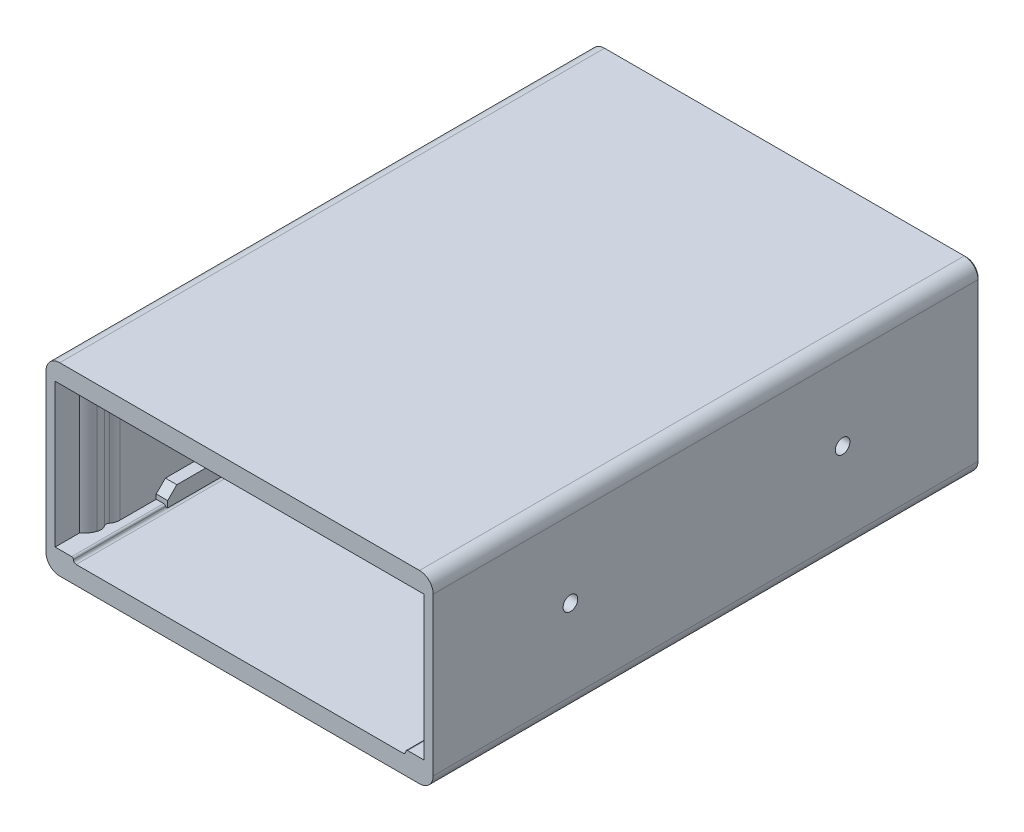
from build123d import *

# Parameters (mm, degrees)
EXTRUDE_1_DEPTH     = 119.5
CUT_EXTRUDE_1_DEPTH = 115.5
SKETCH_3_R          = 1.4
CUT_EXTRUDE_2_DEPTH = 4
EXTRUDE_2_DEPTH     = 2.5
EXTRUDE_3_DEPTH     = 2.5
CUT_EXTRUDE_3_DEPTH = 31.4
CHAMFER_1_SIZE      = 0.4
SKETCH_3_3_R        = 1.4
CUT_EXTRUDE_4_DEPTH = 2.5
SKETCH_3_4_R        = 1.4
CUT_EXTRUDE_5_DEPTH = 4
SKETCH_9_R          = 1.6
CUT_EXTRUDE_6_DEPTH = 148.893469266
CHAMFER_4_SIZE      = 0.4
CHAMFER_5_SIZE      = 0.4


with BuildPart() as part:
    # 草图1 → 凸台-拉伸1 (new body)
    with BuildSketch(Plane.XY):
        with BuildLine():
            Line((-38.75609893, 20.654436608), (39.89390107, 20.654436608))
            ThreePointArc((39.89390107, 20.654436608), (42.015221413, 19.775756952), (42.89390107, 17.654436608))
            Line((42.89390107, 17.654436608), (42.89390107, -16.745563392))
            ThreePointArc((42.89390107, -16.745563392), (42.015221413, -18.866883735), (39.89390107, -19.745563392))
            Line((39.89390107, -19.745563392), (-38.75609893, -19.745563392))
            ThreePointArc((-38.75609893, -19.745563392), (-40.877419274, -18.866883735), (-41.75609893, -16.745563392))
            Line((-41.75609893, -16.745563392), (-41.75609893, 17.654436608))
            ThreePointArc((-41.75609893, 17.654436608), (-40.877419274, 19.775756952), (-38.75609893, 20.654436608))
        make_face()
    extrude(amount=EXTRUDE_1_DEPTH)

    # 草图2 → 切除-拉伸1 (cut)
    with BuildSketch(Plane.XY.offset(119.5)):
        with BuildLine():
            Line((-37.75609893, 16.654436608), (38.89390107, 16.654436608))
            Line((38.89390107, 16.654436608), (38.89390107, -14.745563392))
            Line((38.89390107, -14.745563392), (37.319829514, -14.745563392))
            ThreePointArc((37.319829514, -14.745563392), (37.022296896, -14.866580802), (36.893704546, -15.160918839))
            ThreePointArc((36.893704546, -15.160918839), (36.712700981, -15.575222133), (36.29390107, -15.745563392))
            Line((36.29390107, -15.745563392), (-35.15609893, -15.745563392))
            ThreePointArc((-35.15609893, -15.745563392), (-35.580362999, -15.56982746), (-35.75609893, -15.145563392))
            Line((-35.75609893, -15.145563392), (-35.75609893, -15.142198174))
            ThreePointArc((-35.75609893, -15.142198174), (-35.868562438, -14.862087147), (-36.147008919, -14.745563392))
            Line((-36.147008919, -14.745563392), (-37.75609893, -14.745563392))
            Line((-37.75609893, -14.745563392), (-37.75609893, 16.654436608))
        make_face()
    extrude(amount=-CUT_EXTRUDE_1_DEPTH, mode=Mode.SUBTRACT)

    # 草图3 → 切除-拉伸2 (cut)
    with BuildSketch(Plane.XY.offset(4)):
        with BuildLine():
            Line((29.39390107, 16.654436608), (-28.25609893, 16.654436608))
            Line((-28.25609893, 16.654436608), (-28.25609893, 12.454436608))
            ThreePointArc((-28.25609893, 12.454436608), (-29.281225196, 9.979562874), (-31.75609893, 8.954436608))
            Line((-31.75609893, 8.954436608), (-37.75609893, 8.954436608))
            Line((-37.75609893, 8.954436608), (-37.75609893, -7.045563392))
            Line((-37.75609893, -7.045563392), (-31.75609893, -7.045563392))
            ThreePointArc((-31.75609893, -7.045563392), (-29.281225196, -8.070689657), (-28.25609893, -10.545563392))
            Line((-28.25609893, -10.545563392), (-28.25609893, -15.745563392))
            Line((-28.25609893, -15.745563392), (29.39390107, -15.745563392))
            Line((29.39390107, -15.745563392), (29.39390107, -10.545563392))
            ThreePointArc((29.39390107, -10.545563392), (30.419027336, -8.070689657), (32.89390107, -7.045563392))
            Line((32.89390107, -7.045563392), (38.89390107, -7.045563392))
            Line((38.89390107, -7.045563392), (38.89390107, 8.954436608))
            Line((38.89390107, 8.954436608), (32.89390107, 8.954436608))
            ThreePointArc((32.89390107, 8.954436608), (30.419027336, 9.979562874), (29.39390107, 12.454436608))
            Line((29.39390107, 12.454436608), (29.39390107, 16.654436608))
        make_face()
        with Locations((-31.75609893, -10.545563392)):
            Circle(SKETCH_3_R)
        with Locations((32.89390107, 12.454436608)):
            Circle(SKETCH_3_R)
        with Locations((32.89390107, -10.545563392)):
            Circle(SKETCH_3_R)
    extrude(amount=-CUT_EXTRUDE_2_DEPTH, mode=Mode.SUBTRACT)

    # 草图4 → 凸台-拉伸2 (add)
    with BuildSketch(Plane.ZY.offset(-38.89390107)):
        Polygon((19.4, 3.254436608), (97.4, 3.254436608), (99.4, 1.254436608), (99.4, 0.654436608), (97.4, -1.345563392), (19.4, -1.345563392), align=None)
        Polygon((20.146290163, 16.654436608), (99.4, 16.654436608), (99.4, 15.654436608), (97.4, 13.654436608), (20.146290163, 13.654436608), align=None)
        Polygon((19.4, -11.745563392), (97.4, -11.745563392), (99.4, -13.745563392), (99.4, -15.145563392), (19.4, -15.145563392), align=None)
    extrude(amount=EXTRUDE_2_DEPTH)

    # 草图6 → 凸台-拉伸3 (add)
    with BuildSketch(Plane(origin=(-37.75609893, 0, 0), x_dir=(0, 0, -1), z_dir=(1, 0, 0))):
        Polygon((-99.4, 16.654436608), (-19.4, 16.654436608), (-19.4, 13.654436608), (-97.4, 13.654436608), (-99.4, 15.654436608), align=None)
        Polygon((-97.4, 3.254436608), (-19.4, 3.254436608), (-19.4, -1.345563392), (-97.4, -1.345563392), (-99.4, 0.654436608), (-99.4, 1.254436608), align=None)
        Polygon((-97.4, -11.745563392), (-19.4, -11.745563392), (-19.4, -15.145563392), (-99.4, -15.145563392), (-99.4, -13.745563392), align=None)
    extrude(amount=EXTRUDE_3_DEPTH)

    # 草图8 → 切除-拉伸3 (cut)
    with BuildSketch(Plane.XZ.offset(-16.654436608)):
        with BuildLine():
            Line((-39.75609893, 114.19), (-39.75609893, 119.5))
            Line((-39.75609893, 119.5), (-34.75609893, 119.5))
            Line((-34.75609893, 119.5), (-34.75609893, 107.305312266))
            Line((-34.75609893, 107.305312266), (-37.75609893, 107.305312266))
            ThreePointArc((-37.75609893, 107.305312266), (-37.902054498, 108.229666299), (-38.325719183, 109.064077255))
            ThreePointArc((-38.325719183, 109.064077255), (-38.505927368, 109.602965716), (-38.346327705, 110.148313046))
            ThreePointArc((-38.346327705, 110.148313046), (-38.025073016, 111.013058128), (-38.12609893, 111.93))
            ThreePointArc((-38.12609893, 111.93), (-38.780481743, 113.175843369), (-39.75609893, 114.19))
        make_face()
        with BuildLine():
            Line((38.89390107, 107.18052563), (35.89390107, 107.18052563))
            Line((35.89390107, 107.18052563), (35.89390107, 119.5))
            Line((35.89390107, 119.5), (40.89390107, 119.5))
            Line((40.89390107, 119.5), (40.89390107, 114.19))
            ThreePointArc((40.89390107, 114.19), (39.886150452, 113.181702896), (39.20390107, 111.93))
            ThreePointArc((39.20390107, 111.93), (39.097168141, 110.960326838), (39.461822803, 110.055514737))
            ThreePointArc((39.461822803, 110.055514737), (39.64389997, 109.497678446), (39.463521323, 108.939290618))
            ThreePointArc((39.463521323, 108.939290618), (39.039856638, 108.104879663), (38.89390107, 107.18052563))
        make_face()
    extrude(amount=CUT_EXTRUDE_3_DEPTH, mode=Mode.SUBTRACT)

    # 倒角1
    chamfer_1_edges = [part.edges().sort_by_distance(p)[0] for p in [
        (-40.877419274, 19.775756952, 0),
        (-41.75609893, 0.454436608, 0),
        (-40.877419274, -18.866883735, 0),
        (0.56890107, -19.745563392, 0),
        (42.015221413, -18.866883735, 0),
        (42.89390107, 0.454436608, 0),
        (42.015221413, 19.775756952, 0),
        (0.56890107, 20.654436608, 0),
    ]]
    chamfer(chamfer_1_edges, length=CHAMFER_1_SIZE)

    # 草图3<3> → 切除-拉伸4 (cut)
    with BuildSketch(Plane.XY.offset(4)):
        with Locations((-31.75609893, -10.545563392)):
            Circle(SKETCH_3_3_R)
        with Locations((32.89390107, 12.454436608)):
            Circle(SKETCH_3_3_R)
        with Locations((32.89390107, -10.545563392)):
            Circle(SKETCH_3_3_R)
        with Locations((-31.75609893, 12.454436608)):
            Circle(SKETCH_3_3_R)
        with BuildLine():
            Line((-28.25609893, 16.654436608), (29.39390107, 16.654436608))
            Line((29.39390107, 16.654436608), (29.39390107, 12.454436608))
            ThreePointArc((29.39390107, 12.454436608), (30.419027336, 9.979562874), (32.89390107, 8.954436608))
            Line((32.89390107, 8.954436608), (38.89390107, 8.954436608))
            Line((38.89390107, 8.954436608), (38.89390107, -7.045563392))
            Line((38.89390107, -7.045563392), (32.89390107, -7.045563392))
            ThreePointArc((32.89390107, -7.045563392), (30.419027336, -8.070689657), (29.39390107, -10.545563392))
            Line((29.39390107, -10.545563392), (29.39390107, -15.745563392))
            Line((29.39390107, -15.745563392), (-28.25609893, -15.745563392))
            Line((-28.25609893, -15.745563392), (-28.25609893, -10.545563392))
            ThreePointArc((-28.25609893, -10.545563392), (-29.281225196, -8.070689657), (-31.75609893, -7.045563392))
            Line((-31.75609893, -7.045563392), (-37.75609893, -7.045563392))
            Line((-37.75609893, -7.045563392), (-37.75609893, 8.954436608))
            Line((-37.75609893, 8.954436608), (-31.75609893, 8.954436608))
            ThreePointArc((-31.75609893, 8.954436608), (-29.281225196, 9.979562874), (-28.25609893, 12.454436608))
            Line((-28.25609893, 12.454436608), (-28.25609893, 16.654436608))
        make_face()
    extrude(amount=-CUT_EXTRUDE_4_DEPTH, mode=Mode.SUBTRACT)

    # 草图3<4> → 切除-拉伸5 (cut)
    with BuildSketch(Plane.XY.offset(4)):
        with Locations((-31.75609893, -10.545563392)):
            Circle(SKETCH_3_4_R)
        with Locations((32.89390107, 12.454436608)):
            Circle(SKETCH_3_4_R)
        with Locations((32.89390107, -10.545563392)):
            Circle(SKETCH_3_4_R)
        with Locations((-31.75609893, 12.454436608)):
            Circle(SKETCH_3_4_R)
        with BuildLine():
            Line((-28.25609893, 16.654436608), (29.39390107, 16.654436608))
            Line((29.39390107, 16.654436608), (29.39390107, 12.454436608))
            ThreePointArc((29.39390107, 12.454436608), (30.419027336, 9.979562874), (32.89390107, 8.954436608))
            Line((32.89390107, 8.954436608), (38.89390107, 8.954436608))
            Line((38.89390107, 8.954436608), (38.89390107, -7.045563392))
            Line((38.89390107, -7.045563392), (32.89390107, -7.045563392))
            ThreePointArc((32.89390107, -7.045563392), (30.419027336, -8.070689657), (29.39390107, -10.545563392))
            Line((29.39390107, -10.545563392), (29.39390107, -15.745563392))
            Line((29.39390107, -15.745563392), (-28.25609893, -15.745563392))
            Line((-28.25609893, -15.745563392), (-28.25609893, -10.545563392))
            ThreePointArc((-28.25609893, -10.545563392), (-29.281225196, -8.070689657), (-31.75609893, -7.045563392))
            Line((-31.75609893, -7.045563392), (-37.75609893, -7.045563392))
            Line((-37.75609893, -7.045563392), (-37.75609893, 8.954436608))
            Line((-37.75609893, 8.954436608), (-31.75609893, 8.954436608))
            ThreePointArc((-31.75609893, 8.954436608), (-29.281225196, 9.979562874), (-28.25609893, 12.454436608))
            Line((-28.25609893, 12.454436608), (-28.25609893, 16.654436608))
        make_face()
    extrude(amount=-CUT_EXTRUDE_5_DEPTH, mode=Mode.SUBTRACT)

    # 草图9 → 切除-拉伸6 (cut, through all)
    with BuildSketch(Plane(origin=(42.89390107, 0, 0), x_dir=(0, 0, -1), z_dir=(1, 0, 0))):
        with Locations((-89.5, 0.954436608)):
            Circle(SKETCH_9_R)
        with Locations((-30, 0.954436608)):
            Circle(SKETCH_9_R)
    extrude(amount=-CUT_EXTRUDE_6_DEPTH, mode=Mode.SUBTRACT)

    # 倒角4
    chamfer_4_edges = [part.edges().sort_by_distance(p)[0] for p in [
        (31.49390107, 12.454436608, 0),
        (31.49390107, -10.545563392, 0),
        (-33.15609893, -10.545563392, 0),
        (0.56890107, 16.654436608, 0),
        (29.39390107, 14.554436608, 0),
        (30.419027336, 9.979562874, 0),
        (35.89390107, 8.954436608, 0),
        (38.89390107, 0.954436608, 0),
        (35.89390107, -7.045563392, 0),
        (30.419027336, -8.070689657, 0),
        (29.39390107, -13.145563392, 0),
        (0.56890107, -15.745563392, 0),
        (-28.25609893, -13.145563392, 0),
        (-29.281225196, -8.070689657, 0),
        (-34.75609893, -7.045563392, 0),
        (-37.75609893, 0.954436608, 0),
        (-34.75609893, 8.954436608, 0),
        (-29.281225196, 9.979562874, 0),
        (-28.25609893, 14.554436608, 0),
        (-33.15609893, 12.454436608, 0),
    ]]
    chamfer(chamfer_4_edges, length=CHAMFER_4_SIZE)

    # 倒角5
    chamfer_5_edges = [part.edges().sort_by_distance(p)[0] for p in [
        (29.39390107, -13.145563392, 4),
        (30.419027336, -8.070689657, 4),
        (35.89390107, -7.045563392, 4),
        (31.49390107, -10.545563392, 4),
        (31.49390107, 12.454436608, 4),
        (29.39390107, 14.554436608, 4),
        (30.419027336, 9.979562874, 4),
        (35.89390107, 8.954436608, 4),
        (-33.15609893, -10.545563392, 4),
        (-28.25609893, -13.145563392, 4),
        (-34.75609893, -7.045563392, 4),
        (-29.281225196, -8.070689657, 4),
        (-34.75609893, 8.954436608, 4),
        (-29.281225196, 9.979562874, 4),
        (-28.25609893, 14.554436608, 4),
        (-33.15609893, 12.454436608, 4),
    ]]
    chamfer(chamfer_5_edges, length=CHAMFER_5_SIZE)


solid = part.part
